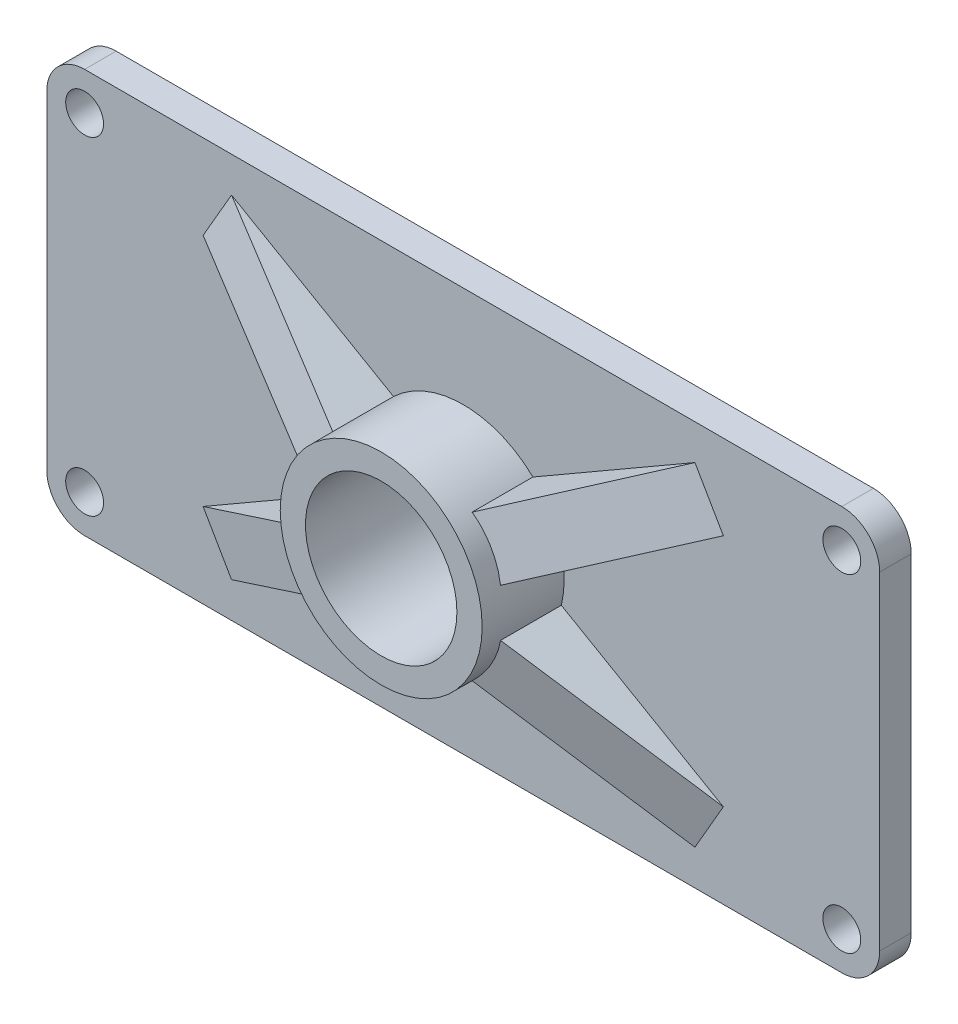
from build123d import *

# Parameters (mm, degrees)
SKETCH1_R               = 3
SKETCH1_R_2             = 12
BOSS_EXTRUDE1_DEPTH     = 5
SKETCH2_R               = 16
SKETCH2_R_2             = 12
BOSS_EXTRUDE2_DEPTH     = 13
RIB1_REACH              = 77.525
SKETCH5_WALL_W          = 183.54206521
SKETCH5_WALL_H          = 9
CIRPATTERN1_COUNT       = 2
MIRROR1_COPY_1_REACH    = 77.525
MIRROR1_COPY_1_SKETCH_W = 183.54206521
MIRROR1_COPY_1_SKETCH_H = 9
MIRROR1_COPY_2_REACH    = 77.525
MIRROR1_COPY_2_SKETCH_W = 183.54206521
MIRROR1_COPY_2_SKETCH_H = 9


with BuildPart() as part:
    # Sketch1 → Boss-Extrude1 (new body)
    with BuildSketch(Plane.XY):
        with BuildLine():
            Line((-60, -32), (60, -32))
            ThreePointArc((60, -32), (64.242640687, -30.242640687), (66, -26))
            Line((66, -26), (66, 26))
            ThreePointArc((66, 26), (64.242640687, 30.242640687), (60, 32))
            Line((60, 32), (-60, 32))
            ThreePointArc((-60, 32), (-64.242640687, 30.242640687), (-66, 26))
            Line((-66, 26), (-66, -26))
            ThreePointArc((-66, -26), (-64.242640687, -30.242640687), (-60, -32))
        make_face()
        with Locations((-60, -26)):
            Circle(SKETCH1_R, mode=Mode.SUBTRACT)
        with Locations((-60, 26)):
            Circle(SKETCH1_R, mode=Mode.SUBTRACT)
        with Locations((60, 26)):
            Circle(SKETCH1_R, mode=Mode.SUBTRACT)
        with Locations((60, -26)):
            Circle(SKETCH1_R, mode=Mode.SUBTRACT)
        Circle(SKETCH1_R_2, mode=Mode.SUBTRACT)
    extrude(amount=BOSS_EXTRUDE1_DEPTH)

    # Sketch2 → Boss-Extrude2 (add)
    with BuildSketch(Plane.XY.offset(5)):
        Circle(SKETCH2_R)
        Circle(SKETCH2_R_2, mode=Mode.SUBTRACT)
    extrude(amount=BOSS_EXTRUDE2_DEPTH)

    # Sketch5 wall → Rib1 (add, up to next)
    with BuildSketch(Plane(origin=(26.413774815, -15.25, 9.711335595), x_dir=(0.823639103536, -0.475528258156, -0.309016994388), z_dir=(0.267616567342, -0.154508497194, 0.951056516291)), mode=Mode.PRIVATE) as rib1_sk1:
        Rectangle(SKETCH5_WALL_W, SKETCH5_WALL_H)
    rib1_tool1 = extrude(rib1_sk1.sketch, amount=-RIB1_REACH, mode=Mode.PRIVATE) - part.part
    rib1 = rib1_tool1.solids().sort_by_distance((26.413774815, -15.25, 9.711335595))[0]
    add(rib1)

    # CirPattern1: Rib1 ×2 about axis
    cirpattern1_axis = Axis((0, 0, 18), (0, 0, 1))
    for i in range(1, CIRPATTERN1_COUNT):
        add(rib1.rotate(cirpattern1_axis, i * 360 / CIRPATTERN1_COUNT))

    # Mirror1 copy 1 sketch → Mirror1 copy 1 (add, up to next)
    with BuildSketch(Plane(origin=(-26.413774815, -15.25, 9.711335595), x_dir=(-0.8236391035359999, -0.47552825815600014, -0.309016994388), z_dir=(-0.267616567342, -0.15450849719400003, 0.951056516291)), mode=Mode.PRIVATE) as mirror1_copy_1_sk1:
        Rectangle(MIRROR1_COPY_1_SKETCH_W, MIRROR1_COPY_1_SKETCH_H)
    mirror1_copy_1_tool1 = extrude(mirror1_copy_1_sk1.sketch, amount=-MIRROR1_COPY_1_REACH, mode=Mode.PRIVATE) - part.part
    add(mirror1_copy_1_tool1.solids().sort_by_distance((-26.413774815, -15.25, 9.711335595))[0])

    # Mirror1 copy 2 sketch → Mirror1 copy 2 (add, up to next)
    with BuildSketch(Plane(origin=(26.413774815, 15.25, 9.711335595), x_dir=(0.823639103536, 0.475528258156, -0.309016994388), z_dir=(0.267616567342, 0.154508497194, 0.951056516291)), mode=Mode.PRIVATE) as mirror1_copy_2_sk1:
        Rectangle(MIRROR1_COPY_2_SKETCH_W, MIRROR1_COPY_2_SKETCH_H)
    mirror1_copy_2_tool1 = extrude(mirror1_copy_2_sk1.sketch, amount=-MIRROR1_COPY_2_REACH, mode=Mode.PRIVATE) - part.part
    add(mirror1_copy_2_tool1.solids().sort_by_distance((26.413774815, 15.25, 9.711335595))[0])


solid = part.part
